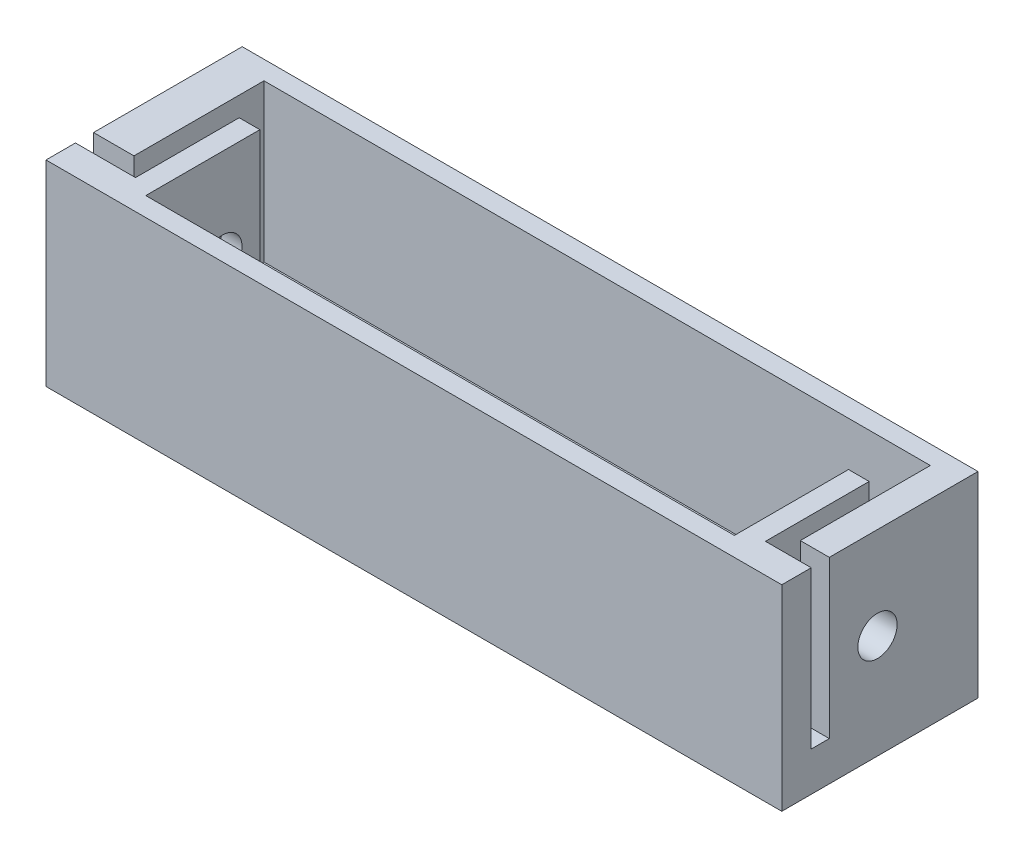
from build123d import *

# Parameters (mm, degrees)
SKETCH1_W           = 75
SKETCH1_H           = 20
BOSS_EXTRUDE1_DEPTH = 20
CUT_EXTRUDE2_DEPTH  = 16
SKETCH3_R           = 2
CUT_EXTRUDE3_DEPTH  = 96


with BuildPart() as part:
    # Sketch1 → Boss-Extrude1 (new body)
    with BuildSketch(Plane.XY):
        with Locations((-0.726872247, 21.927312775)):
            Rectangle(SKETCH1_W, SKETCH1_H)
    extrude(amount=BOSS_EXTRUDE1_DEPTH)

    # Sketch2 → Cut-Extrude2 (cut)
    with BuildSketch(Plane(origin=(0, 31.927312775, 0), x_dir=(1, 0, 0), z_dir=(0, 1, 0))):
        Polygon((36.773127753, -16.997338724), (36.773127753, -15.156017778), (34.105822873, -15.156017778), (33.814685074, -15.156017778), (33.814685074, -4.376760328), (33.814685074, -1.902190301), (32.105822873, -1.902190301), (-32.105822873, -1.902190301), (-34.105822873, -1.902190301), (-34.105822873, -4.376760328), (-34.105822873, -15.156017778), (-38.226872247, -15.156017778), (-38.226872247, -16.997338724), (-32.105822873, -16.997338724), (-32.105822873, -6.427465258), (-30, -6.427465258), (-30, -18.05964209), (30, -18.05964209), (30, -6.427465258), (32.105822873, -6.427465258), (32.105822873, -16.997338724), align=None)
    extrude(amount=-CUT_EXTRUDE2_DEPTH, mode=Mode.SUBTRACT)

    # Sketch3 → Cut-Extrude3 (cut)
    with BuildSketch(Plane(origin=(36.773127753, 0, 0), x_dir=(0, 0, -1), z_dir=(1, 0, 0))):
        with Locations(Location((-10.245692038, 22.537083277, 0), (0, 0, 90))):
            Circle(SKETCH3_R)
    extrude(amount=-CUT_EXTRUDE3_DEPTH, mode=Mode.SUBTRACT)


solid = part.part
